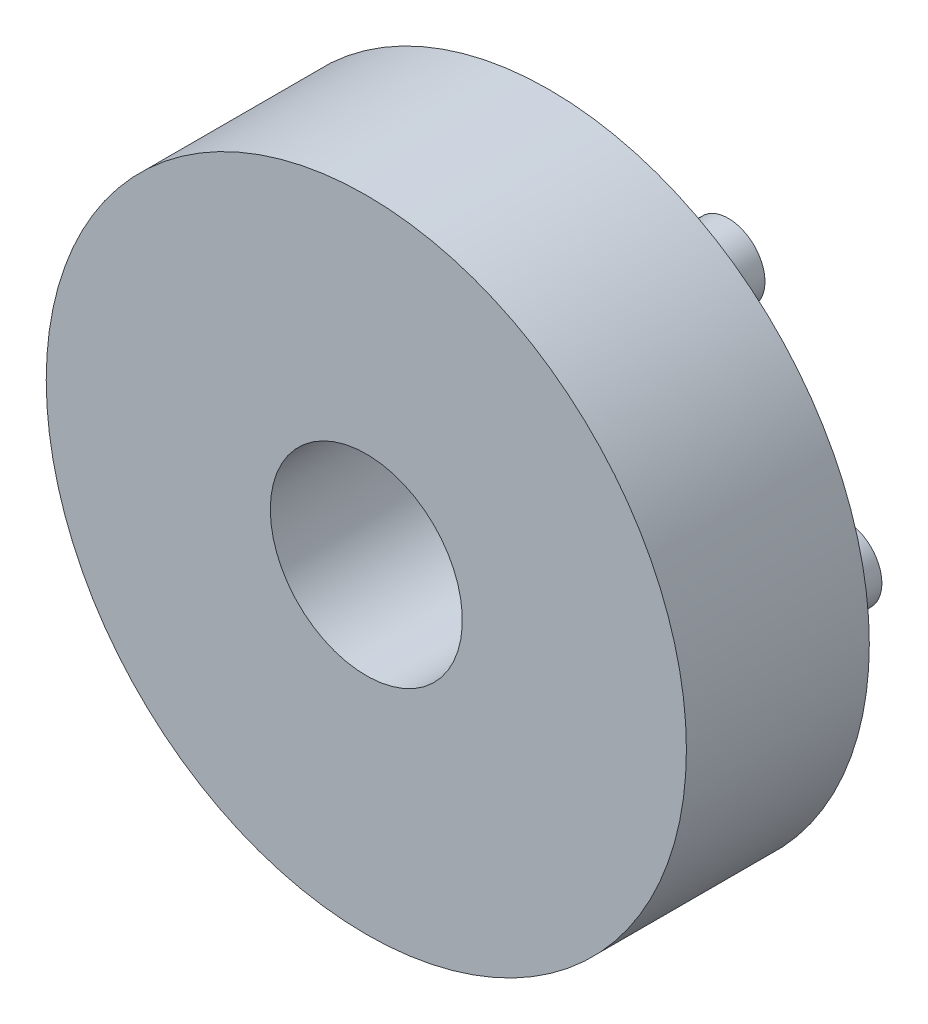
from build123d import *

# Parameters (mm, degrees)
ESQUISSE1_R             = 35
ESQUISSE1_R_2           = 7
BOSS_EXTRU_1_DEPTH      = 20
ESQUISSE2_R             = 14
ENL_V_MAT_EXTRU_1_DEPTH = 5
ESQUISSE3_R             = 4
ENL_V_MAT_EXTRU_3_DEPTH = 5
ESQUISSE8_R             = 14
ENL_V_MAT_EXTRU_4_DEPTH = 25
BOSS_EXTRU_2_DEPTH      = 6
BOSS_EXTRU_2_DEPTH_BACK = 9
ESQUISSE9_R             = 4
ESQUISSE10_R            = 14
ESQUISSE10_R_2          = 10.5
BOSS_EXTRU_3_DEPTH      = 20


with BuildPart() as part:
    # Esquisse1 → Boss.-Extru.1 (new body)
    with BuildSketch(Plane.XY):
        Circle(ESQUISSE1_R)
        Circle(ESQUISSE1_R_2, mode=Mode.SUBTRACT)
    extrude(amount=BOSS_EXTRU_1_DEPTH)

    # Esquisse2 → Enlèv. mat.-Extru.1 (cut)
    with BuildSketch(Plane(origin=(0, 0, 0), x_dir=(-1, 0, 0), z_dir=(0, 0, -1))):
        Circle(ESQUISSE2_R)
    extrude(amount=-ENL_V_MAT_EXTRU_1_DEPTH, mode=Mode.SUBTRACT)

    # Esquisse3 → Enlèv. mat.-Extru.3 (cut)
    with BuildSketch(Plane(origin=(0, 0, 0), x_dir=(-1, 0, 0), z_dir=(0, 0, -1))):
        with Locations((-13.588993608, 22.602101614)):
            Circle(ESQUISSE3_R)
        with Locations((13.588993608, 22.602101614)):
            Circle(ESQUISSE3_R)
        with Locations((26.369096609, 0.431843358)):
            Circle(ESQUISSE3_R)
        with Locations((12.841601354, -23.034952123)):
            Circle(ESQUISSE3_R)
        with Locations((-12.82933858, -23.041784138)):
            Circle(ESQUISSE3_R)
        with Locations((-26.369096609, 0.431843358)):
            Circle(ESQUISSE3_R)
    extrude(amount=-ENL_V_MAT_EXTRU_3_DEPTH, mode=Mode.SUBTRACT)

    # Esquisse8 → Enlèv. mat.-Extru.4 (cut)
    with BuildSketch(Plane(origin=(0, 0, 0), x_dir=(-1, 0, 0), z_dir=(0, 0, -1))):
        Circle(ESQUISSE8_R)
    extrude(amount=-ENL_V_MAT_EXTRU_4_DEPTH, mode=Mode.SUBTRACT)

    # Esquisse9 → Boss.-Extru.2 (add, two sides: drawn at the far end of the back side and taken through both)
    with BuildSketch(Plane(origin=(0, 0, 0), x_dir=(-1, 0, 0), z_dir=(0, 0, -1)).offset(-BOSS_EXTRU_2_DEPTH_BACK)):
        with Locations((-13.588993608, 22.602101614)):
            Circle(ESQUISSE9_R)
        with Locations((13.588993608, 22.602101614)):
            Circle(ESQUISSE9_R)
        with Locations((26.369096609, 0.431843358)):
            Circle(ESQUISSE9_R)
        with Locations((12.841601354, -23.034952123)):
            Circle(ESQUISSE9_R)
        with Locations((-12.82933858, -23.041784138)):
            Circle(ESQUISSE9_R)
        with Locations((-26.369096609, 0.431843358)):
            Circle(ESQUISSE9_R)
    extrude(amount=BOSS_EXTRU_2_DEPTH + BOSS_EXTRU_2_DEPTH_BACK)

    # Esquisse10 → Boss.-Extru.3 (add)
    with BuildSketch(Plane(origin=(0, 0, 0), x_dir=(-1, 0, 0), z_dir=(0, 0, -1))):
        Circle(ESQUISSE10_R)
        Circle(ESQUISSE10_R_2, mode=Mode.SUBTRACT)
    extrude(amount=-BOSS_EXTRU_3_DEPTH)


solid = part.part
